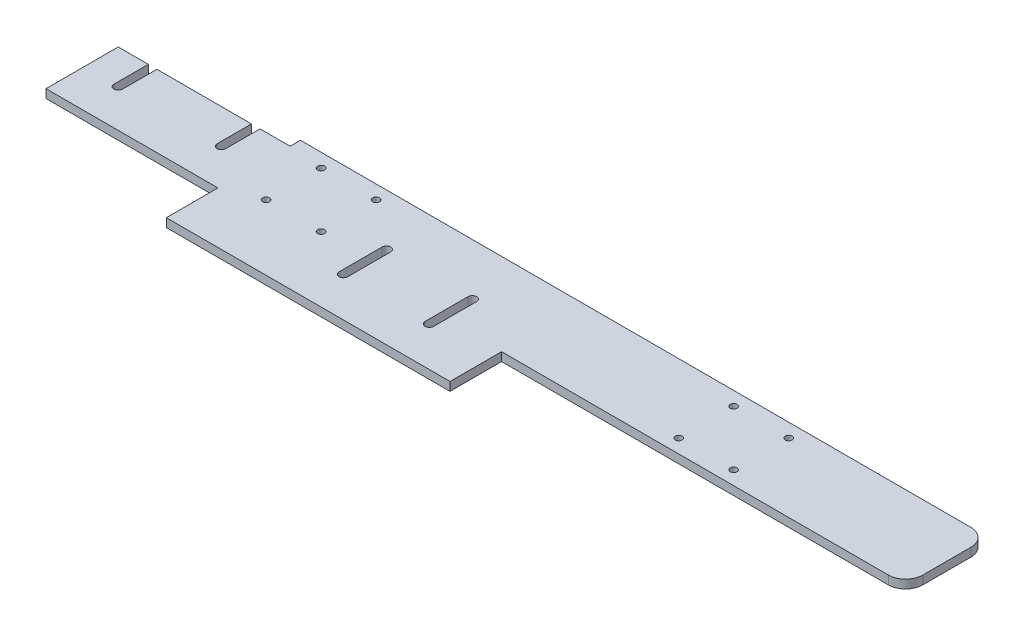
from build123d import *

# Parameters (mm, degrees)
SKETCH1_W           = 400
SKETCH1_H           = 48
SKETCH1_R           = 2
BOSS_EXTRUDE1_DEPTH = 5
SKETCH3_W           = 42
SKETCH3_H           = 5
BOSS_EXTRUDE2_DEPTH = 100
SKETCH5_W           = 165
SKETCH5_H           = 5
BOSS_EXTRUDE3_DEPTH = 30
CUT_EXTRUDE1_DEPTH  = 408.564718787
FILLET1_R           = 10


with BuildPart() as part:
    # Sketch1 → Boss-Extrude1 (new body)
    with BuildSketch(Plane(origin=(0, 0, 0), x_dir=(1, 0, 0), z_dir=(0, 1, 0))):
        with Locations((200, -24)):
            Rectangle(SKETCH1_W, SKETCH1_H)
        with Locations(Location((20, -8, 0), (0, 0, 270))):
            Circle(SKETCH1_R, mode=Mode.SUBTRACT)
        with Locations(Location((20, -40, 0), (0, 0, 90))):
            Circle(SKETCH1_R, mode=Mode.SUBTRACT)
        with Locations(Location((292, -8, 0), (0, 0, 270))):
            Circle(SKETCH1_R, mode=Mode.SUBTRACT)
        with Locations(Location((292, -40, 0), (0, 0, 90))):
            Circle(SKETCH1_R, mode=Mode.SUBTRACT)
        with Locations(Location((52, -40, 0), (0, 0, 270))):
            Circle(SKETCH1_R, mode=Mode.SUBTRACT)
        with Locations(Location((52, -8, 0), (0, 0, 90))):
            Circle(SKETCH1_R, mode=Mode.SUBTRACT)
        with Locations(Location((260, -40, 0), (0, 0, 270))):
            Circle(SKETCH1_R, mode=Mode.SUBTRACT)
        with Locations(Location((260, -8, 0), (0, 0, 90))):
            Circle(SKETCH1_R, mode=Mode.SUBTRACT)
    extrude(amount=BOSS_EXTRUDE1_DEPTH)

    # Sketch3 → Boss-Extrude2 (add)
    with BuildSketch(Plane.ZY):
        with Locations((27, 2.5)):
            Rectangle(SKETCH3_W, SKETCH3_H)
    extrude(amount=BOSS_EXTRUDE2_DEPTH)

    # Sketch5 → Boss-Extrude3 (add)
    with BuildSketch(Plane.XY.offset(48)):
        with Locations((82.5, 2.5)):
            Rectangle(SKETCH5_W, SKETCH5_H)
    extrude(amount=BOSS_EXTRUDE3_DEPTH)

    # Sketch4 → Cut-Extrude1 (cut, through all)
    with BuildSketch(Plane(origin=(0, 5, 0), x_dir=(1, 0, 0), z_dir=(0, 1, 0))):
        with BuildLine():
            Line((-77.5, -6), (-77.5, -26))
            ThreePointArc((-77.5, -26), (-80, -28.5), (-82.5, -26))
            Line((-82.5, -26), (-82.5, -6))
            ThreePointArc((-82.5, -6), (-80, -3.5), (-77.5, -6))
        make_face()
        with BuildLine():
            Line((-17.5, -6), (-17.5, -26))
            ThreePointArc((-17.5, -26), (-20, -28.5), (-22.5, -26))
            Line((-22.5, -26), (-22.5, -6))
            ThreePointArc((-22.5, -6), (-20, -3.5), (-17.5, -6))
        make_face()
        with BuildLine():
            Line((82.5, -30), (82.5, -55))
            ThreePointArc((82.5, -55), (80, -57.5), (77.5, -55))
            Line((77.5, -55), (77.5, -30))
            ThreePointArc((77.5, -30), (80, -27.5), (82.5, -30))
        make_face()
        with BuildLine():
            Line((132.5, -30), (132.5, -55))
            ThreePointArc((132.5, -55), (130, -57.5), (127.5, -55))
            Line((127.5, -55), (127.5, -30))
            ThreePointArc((127.5, -30), (130, -27.5), (132.5, -30))
        make_face()
    extrude(amount=-CUT_EXTRUDE1_DEPTH, mode=Mode.SUBTRACT)

    # Fillet1
    fillet1_edges = [part.edges().sort_by_distance(p)[0] for p in [
        (400, 2.5, 0),
        (400, 2.5, 48),
    ]]
    fillet(fillet1_edges, radius=FILLET1_R)


solid = part.part
